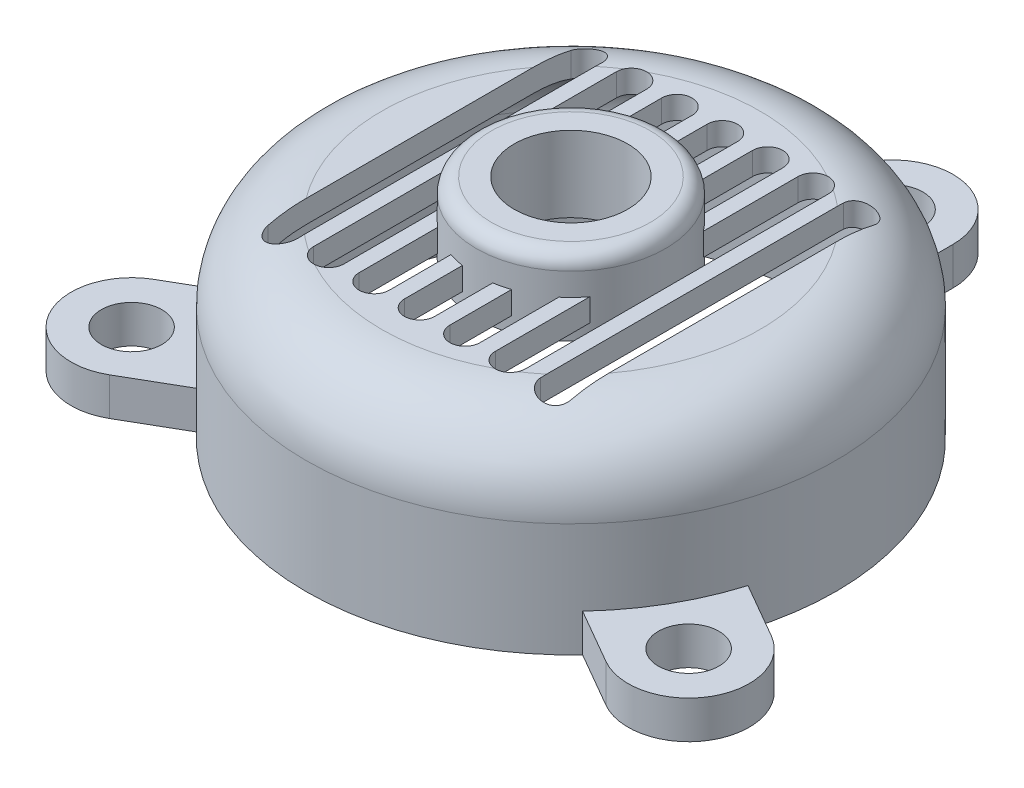
from build123d import *

# Parameters (mm, degrees)
SKETCH1_R                = 35
BOSS_EXTRUDE1_DEPTH      = 25
FILLET1_R                = 10
SHELL1_T                 = -3
SKETCH3_R                = 4
BOSS_EXTRUDE2_DEPTH      = 5
CIRPATTERN1_COUNT        = 3
CUT_EXTRUDE1_DEPTH       = 72.991907702
LPATTERN1_COUNT          = 7
LPATTERN1_PITCH          = 6
BOSS_EXTRUDE4_DEPTH      = 5
BOSS_EXTRUDE4_DEPTH_BACK = 5
SKETCH14_R               = 12.5
SKETCH15_R               = 7.5
CUT_EXTRUDE2_DEPTH       = 74.877160033
FILLET3_R                = 2


with BuildPart() as part:
    # Sketch1 → Boss-Extrude1 (new body)
    with BuildSketch(Plane(origin=(0, 0, 0), x_dir=(1, 0, 0), z_dir=(0, 1, 0))):
        with Locations(Location((0, 0, 0), (0, 0, 270))):
            Circle(SKETCH1_R)
    extrude(amount=BOSS_EXTRUDE1_DEPTH)

    # Fillet1
    fillet1_edges = [part.edges().sort_by_distance(p)[0] for p in [
        (0, 25, -35),
    ]]
    fillet(fillet1_edges, radius=FILLET1_R)

    # Shell1
    shell1_openings = [part.faces().sort_by_distance(p)[0] for p in [
        (0, 0, 0),
    ]]
    offset(amount=SHELL1_T, openings=shell1_openings, kind=Kind.INTERSECTION)

    # Sketch3 → Boss-Extrude2 (add)
    with BuildSketch(Plane(origin=(0, 0, 0), x_dir=(1, 0, 0), z_dir=(0, 1, 0))):
        with BuildLine():
            Line((-8, 34.073450075), (8, 34.073450075))
            Line((8, 34.073450075), (8, 42.5))
            ThreePointArc((8, 42.5), (0, 50.5), (-8, 42.5))
            Line((-8, 42.5), (-8, 34.073450075))
        make_face()
        with Locations(Location((0, 42.5, 0), (0, 0, 270))):
            Circle(SKETCH3_R, mode=Mode.SUBTRACT)
    boss_extrude2 = extrude(amount=BOSS_EXTRUDE2_DEPTH)

    # CirPattern1: Boss-Extrude2 ×3 about axis
    cirpattern1_axis = Axis((0, 0, 0), (0, 1, 0))
    for i in range(1, CIRPATTERN1_COUNT):
        add(boss_extrude2.rotate(cirpattern1_axis, i * 360 / CIRPATTERN1_COUNT))

    # Sketch4 → Cut-Extrude1 (cut, through all)
    with BuildSketch(Plane(origin=(0, 25, 0), x_dir=(1, 0, 0), z_dir=(0, 1, 0))):
        with BuildLine():
            Line((-16, 20), (-16, -20))
            ThreePointArc((-16, -20), (-18, -22), (-20, -20))
            Line((-20, -20), (-20, 20))
            ThreePointArc((-20, 20), (-18, 22), (-16, 20))
        make_face()
    cut_extrude1 = extrude(amount=-CUT_EXTRUDE1_DEPTH, mode=Mode.SUBTRACT)

    # LPattern1: Cut-Extrude1 ×7
    with Locations(*[(i * LPATTERN1_PITCH, 0, 0) for i in range(1, LPATTERN1_COUNT)]):
        add(cut_extrude1, mode=Mode.SUBTRACT)

    # Sketch14 → Boss-Extrude4 (add, two sides: drawn at the far end of the back side and taken through both)
    with BuildSketch(Plane(origin=(0, 25, 0), x_dir=(1, 0, 0), z_dir=(0, 1, 0)).offset(-BOSS_EXTRUDE4_DEPTH_BACK)):
        with Locations(Location((0, 0, 0), (0, 0, 270))):
            Circle(SKETCH14_R)
    extrude(amount=BOSS_EXTRUDE4_DEPTH + BOSS_EXTRUDE4_DEPTH_BACK)

    # Sketch15 → Cut-Extrude2 (cut, through all)
    with BuildSketch(Plane(origin=(0, 30, 0), x_dir=(1, 0, 0), z_dir=(0, 1, 0))):
        with Locations(Location((0, 0, 0), (0, 0, 270))):
            Circle(SKETCH15_R)
    extrude(amount=-CUT_EXTRUDE2_DEPTH, mode=Mode.SUBTRACT)

    # Fillet3
    fillet3_edges = [part.edges().sort_by_distance(p)[0] for p in [
        (0, 30, -12.5),
    ]]
    fillet(fillet3_edges, radius=FILLET3_R)


solid = part.part
